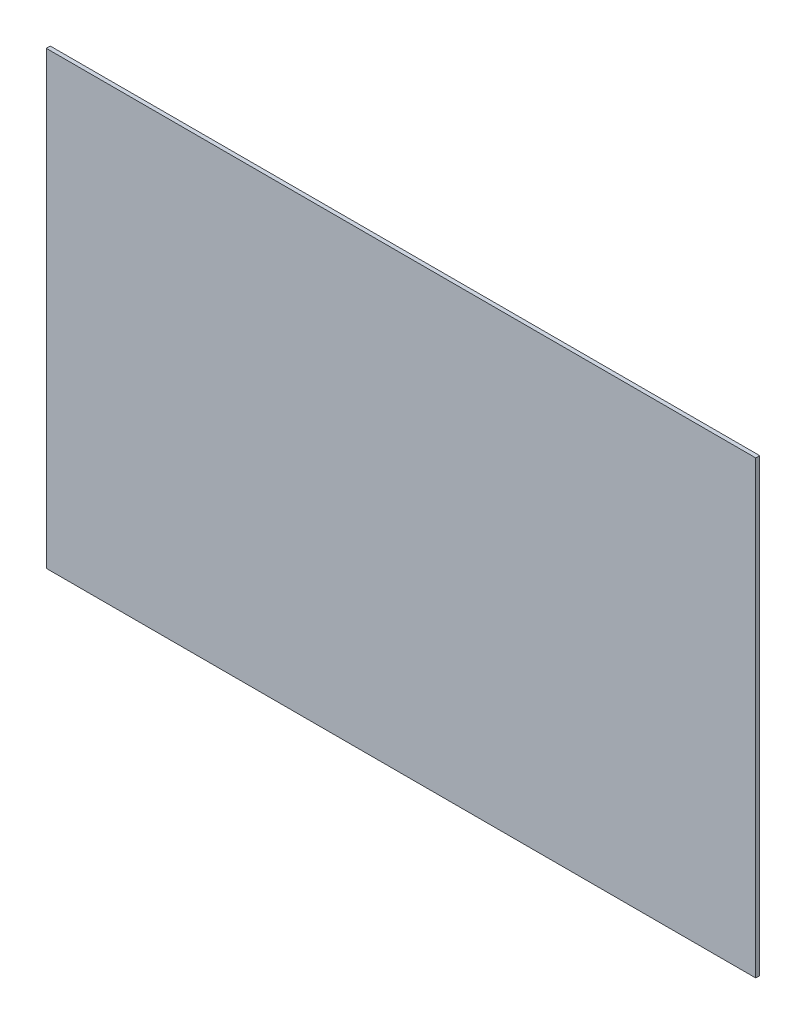
from build123d import *

# Parameters (mm, degrees)
ESBO_O1_W                = 178
ESBO_O1_H                = 113
RESSALTO_EXTRUS_O1_DEPTH = 1


with BuildPart() as part:
    # Esboço1 → Ressalto-extrusão1 (new body)
    with BuildSketch(Plane.XY):
        with Locations((-57.340932524, 40.042310161)):
            Rectangle(ESBO_O1_W, ESBO_O1_H)
    extrude(amount=RESSALTO_EXTRUS_O1_DEPTH)


solid = part.part
